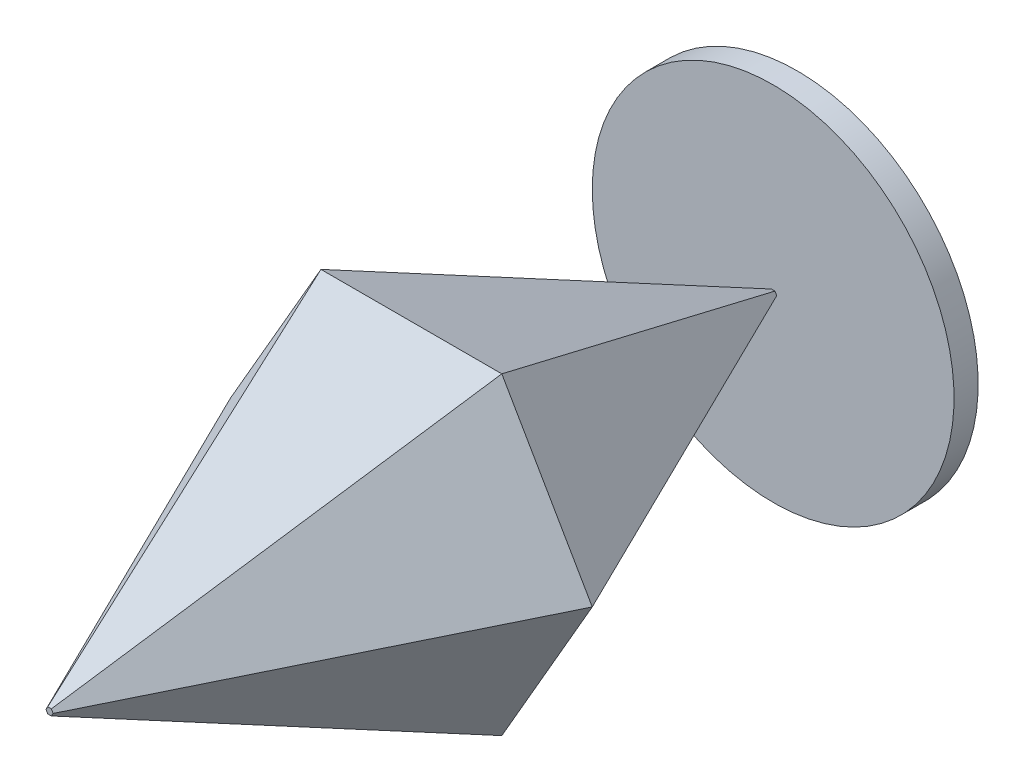
from build123d import *

# Parameters (mm, degrees)
BOSS_EXTRU_1_DEPTH = 30
BOSS_EXTRU_1_TAPER = 23
ESQUISSE2_R        = 15
BOSS_EXTRU_2_DEPTH = 2


with BuildPart() as part:
    # Esquisse1 → Boss.-Extru.1 (new body)
    with BuildSketch(Plane.XY):
        Polygon((15, 0), (7.5, 12.990381057), (-7.5, 12.990381057), (-15, 0), (-7.5, -12.990381057), (7.5, -12.990381057), align=None)
    boss_extru_1 = extrude(amount=BOSS_EXTRU_1_DEPTH, taper=BOSS_EXTRU_1_TAPER)

    # Symétrie1: Boss.-Extru.1 across plane
    add(boss_extru_1.mirror(Plane.XY))

    # Esquisse2 → Boss.-Extru.2 (add)
    with BuildSketch(Plane(origin=(0, 0, -30), x_dir=(-1, 0, 0), z_dir=(0, 0, -1))):
        Circle(ESQUISSE2_R)
    extrude(amount=BOSS_EXTRU_2_DEPTH)


solid = part.part
